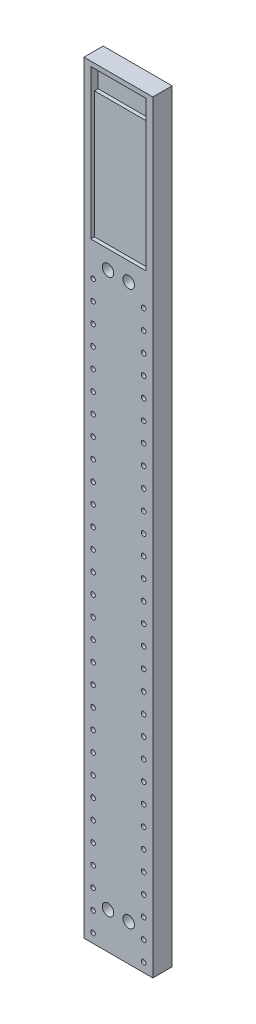
from build123d import *

# Parameters (mm, degrees)
SKETCH1_W                  = 30
SKETCH1_H                  = 330
BOSS_EXTRUDE1_DEPTH        = 8.4
SKETCH2_R                  = 1
CUT_EXTRUDE1_DEPTH         = 332.467283453
LPATTERN1_COUNT            = 30
LPATTERN1_PITCH            = 8.5
LPATTERN2_COUNT            = 2
LPATTERN2_PITCH            = 22
LPATTERN2_COPY_1_SKETCH_R  = 1
LPATTERN2_COPY_1_DEPTH     = 332.467283453
LPATTERN2_COPY_2_SKETCH_R  = 1
LPATTERN2_COPY_2_DEPTH     = 332.467283453
LPATTERN2_COPY_3_SKETCH_R  = 1
LPATTERN2_COPY_3_DEPTH     = 332.467283453
LPATTERN2_COPY_4_SKETCH_R  = 1
LPATTERN2_COPY_4_DEPTH     = 332.467283453
LPATTERN2_COPY_5_SKETCH_R  = 1
LPATTERN2_COPY_5_DEPTH     = 332.467283453
LPATTERN2_COPY_6_SKETCH_R  = 1
LPATTERN2_COPY_6_DEPTH     = 332.467283453
LPATTERN2_COPY_7_SKETCH_R  = 1
LPATTERN2_COPY_7_DEPTH     = 332.467283453
LPATTERN2_COPY_8_SKETCH_R  = 1
LPATTERN2_COPY_8_DEPTH     = 332.467283453
LPATTERN2_COPY_9_SKETCH_R  = 1
LPATTERN2_COPY_9_DEPTH     = 332.467283453
LPATTERN2_COPY_10_SKETCH_R = 1
LPATTERN2_COPY_10_DEPTH    = 332.467283453
LPATTERN2_COPY_11_SKETCH_R = 1
LPATTERN2_COPY_11_DEPTH    = 332.467283453
LPATTERN2_COPY_12_SKETCH_R = 1
LPATTERN2_COPY_12_DEPTH    = 332.467283453
LPATTERN2_COPY_13_SKETCH_R = 1
LPATTERN2_COPY_13_DEPTH    = 332.467283453
LPATTERN2_COPY_14_SKETCH_R = 1
LPATTERN2_COPY_14_DEPTH    = 332.467283453
LPATTERN2_COPY_15_SKETCH_R = 1
LPATTERN2_COPY_15_DEPTH    = 332.467283453
LPATTERN2_COPY_16_SKETCH_R = 1
LPATTERN2_COPY_16_DEPTH    = 332.467283453
LPATTERN2_COPY_17_SKETCH_R = 1
LPATTERN2_COPY_17_DEPTH    = 332.467283453
LPATTERN2_COPY_18_SKETCH_R = 1
LPATTERN2_COPY_18_DEPTH    = 332.467283453
LPATTERN2_COPY_19_SKETCH_R = 1
LPATTERN2_COPY_19_DEPTH    = 332.467283453
LPATTERN2_COPY_20_SKETCH_R = 1
LPATTERN2_COPY_20_DEPTH    = 332.467283453
LPATTERN2_COPY_21_SKETCH_R = 1
LPATTERN2_COPY_21_DEPTH    = 332.467283453
LPATTERN2_COPY_22_SKETCH_R = 1
LPATTERN2_COPY_22_DEPTH    = 332.467283453
LPATTERN2_COPY_23_SKETCH_R = 1
LPATTERN2_COPY_23_DEPTH    = 332.467283453
LPATTERN2_COPY_24_SKETCH_R = 1
LPATTERN2_COPY_24_DEPTH    = 332.467283453
LPATTERN2_COPY_25_SKETCH_R = 1
LPATTERN2_COPY_25_DEPTH    = 332.467283453
LPATTERN2_COPY_26_SKETCH_R = 1
LPATTERN2_COPY_26_DEPTH    = 332.467283453
LPATTERN2_COPY_27_SKETCH_R = 1
LPATTERN2_COPY_27_DEPTH    = 332.467283453
LPATTERN2_COPY_28_SKETCH_R = 1
LPATTERN2_COPY_28_DEPTH    = 332.467283453
LPATTERN2_COPY_29_SKETCH_R = 1
LPATTERN2_COPY_29_DEPTH    = 332.467283453
SKETCH4_W                  = 24
SKETCH4_H                  = 65
CUT_EXTRUDE2_DEPTH         = 1.6
SKETCH6_W                  = 24
SKETCH6_H                  = 10
CUT_EXTRUDE3_DEPTH         = 1.6
SKETCH7_W                  = 30
SKETCH7_H                  = 8.4
BOSS_EXTRUDE2_DEPTH        = 2
SKETCH8_R                  = 2.5
CUT_EXTRUDE4_DEPTH         = 334.458483173


with BuildPart() as part:
    # Sketch1 → Boss-Extrude1 (new body)
    with BuildSketch(Plane.XY):
        with Locations((15, 165)):
            Rectangle(SKETCH1_W, SKETCH1_H)
    extrude(amount=BOSS_EXTRUDE1_DEPTH)

    # Sketch2 → Cut-Extrude1 (cut, through all)
    with BuildSketch(Plane.XY.offset(8.4)):
        with Locations((26, 4)):
            Circle(SKETCH2_R)
    cut_extrude1 = extrude(amount=-CUT_EXTRUDE1_DEPTH, mode=Mode.SUBTRACT)

    # LPattern1: Cut-Extrude1 ×30
    with Locations(*[(0, i * LPATTERN1_PITCH, 0) for i in range(1, LPATTERN1_COUNT)]):
        add(cut_extrude1, mode=Mode.SUBTRACT)

    # LPattern2: Cut-Extrude1 ×2
    with Locations(*[(-i * LPATTERN2_PITCH, 0, 0) for i in range(1, LPATTERN2_COUNT)]):
        add(cut_extrude1, mode=Mode.SUBTRACT)

    # LPattern2 copy 1 sketch → LPattern2 copy 1 (cut, through all)
    with BuildSketch(Plane(origin=(-22, 8.5, 8.4), x_dir=(1, 0, 0), z_dir=(0, 0, 1))):
        with Locations((26, 4)):
            Circle(LPATTERN2_COPY_1_SKETCH_R)
    extrude(amount=-LPATTERN2_COPY_1_DEPTH, mode=Mode.SUBTRACT)

    # LPattern2 copy 2 sketch → LPattern2 copy 2 (cut, through all)
    with BuildSketch(Plane(origin=(-22, 17, 8.4), x_dir=(1, 0, 0), z_dir=(0, 0, 1))):
        with Locations((26, 4)):
            Circle(LPATTERN2_COPY_2_SKETCH_R)
    extrude(amount=-LPATTERN2_COPY_2_DEPTH, mode=Mode.SUBTRACT)

    # LPattern2 copy 3 sketch → LPattern2 copy 3 (cut, through all)
    with BuildSketch(Plane(origin=(-22, 25.5, 8.4), x_dir=(1, 0, 0), z_dir=(0, 0, 1))):
        with Locations((26, 4)):
            Circle(LPATTERN2_COPY_3_SKETCH_R)
    extrude(amount=-LPATTERN2_COPY_3_DEPTH, mode=Mode.SUBTRACT)

    # LPattern2 copy 4 sketch → LPattern2 copy 4 (cut, through all)
    with BuildSketch(Plane(origin=(-22, 34, 8.4), x_dir=(1, 0, 0), z_dir=(0, 0, 1))):
        with Locations((26, 4)):
            Circle(LPATTERN2_COPY_4_SKETCH_R)
    extrude(amount=-LPATTERN2_COPY_4_DEPTH, mode=Mode.SUBTRACT)

    # LPattern2 copy 5 sketch → LPattern2 copy 5 (cut, through all)
    with BuildSketch(Plane(origin=(-22, 42.5, 8.4), x_dir=(1, 0, 0), z_dir=(0, 0, 1))):
        with Locations((26, 4)):
            Circle(LPATTERN2_COPY_5_SKETCH_R)
    extrude(amount=-LPATTERN2_COPY_5_DEPTH, mode=Mode.SUBTRACT)

    # LPattern2 copy 6 sketch → LPattern2 copy 6 (cut, through all)
    with BuildSketch(Plane(origin=(-22, 51, 8.4), x_dir=(1, 0, 0), z_dir=(0, 0, 1))):
        with Locations((26, 4)):
            Circle(LPATTERN2_COPY_6_SKETCH_R)
    extrude(amount=-LPATTERN2_COPY_6_DEPTH, mode=Mode.SUBTRACT)

    # LPattern2 copy 7 sketch → LPattern2 copy 7 (cut, through all)
    with BuildSketch(Plane(origin=(-22, 59.5, 8.4), x_dir=(1, 0, 0), z_dir=(0, 0, 1))):
        with Locations((26, 4)):
            Circle(LPATTERN2_COPY_7_SKETCH_R)
    extrude(amount=-LPATTERN2_COPY_7_DEPTH, mode=Mode.SUBTRACT)

    # LPattern2 copy 8 sketch → LPattern2 copy 8 (cut, through all)
    with BuildSketch(Plane(origin=(-22, 68, 8.4), x_dir=(1, 0, 0), z_dir=(0, 0, 1))):
        with Locations((26, 4)):
            Circle(LPATTERN2_COPY_8_SKETCH_R)
    extrude(amount=-LPATTERN2_COPY_8_DEPTH, mode=Mode.SUBTRACT)

    # LPattern2 copy 9 sketch → LPattern2 copy 9 (cut, through all)
    with BuildSketch(Plane(origin=(-22, 76.5, 8.4), x_dir=(1, 0, 0), z_dir=(0, 0, 1))):
        with Locations((26, 4)):
            Circle(LPATTERN2_COPY_9_SKETCH_R)
    extrude(amount=-LPATTERN2_COPY_9_DEPTH, mode=Mode.SUBTRACT)

    # LPattern2 copy 10 sketch → LPattern2 copy 10 (cut, through all)
    with BuildSketch(Plane(origin=(-22, 85, 8.4), x_dir=(1, 0, 0), z_dir=(0, 0, 1))):
        with Locations((26, 4)):
            Circle(LPATTERN2_COPY_10_SKETCH_R)
    extrude(amount=-LPATTERN2_COPY_10_DEPTH, mode=Mode.SUBTRACT)

    # LPattern2 copy 11 sketch → LPattern2 copy 11 (cut, through all)
    with BuildSketch(Plane(origin=(-22, 93.5, 8.4), x_dir=(1, 0, 0), z_dir=(0, 0, 1))):
        with Locations((26, 4)):
            Circle(LPATTERN2_COPY_11_SKETCH_R)
    extrude(amount=-LPATTERN2_COPY_11_DEPTH, mode=Mode.SUBTRACT)

    # LPattern2 copy 12 sketch → LPattern2 copy 12 (cut, through all)
    with BuildSketch(Plane(origin=(-22, 102, 8.4), x_dir=(1, 0, 0), z_dir=(0, 0, 1))):
        with Locations((26, 4)):
            Circle(LPATTERN2_COPY_12_SKETCH_R)
    extrude(amount=-LPATTERN2_COPY_12_DEPTH, mode=Mode.SUBTRACT)

    # LPattern2 copy 13 sketch → LPattern2 copy 13 (cut, through all)
    with BuildSketch(Plane(origin=(-22, 110.5, 8.4), x_dir=(1, 0, 0), z_dir=(0, 0, 1))):
        with Locations((26, 4)):
            Circle(LPATTERN2_COPY_13_SKETCH_R)
    extrude(amount=-LPATTERN2_COPY_13_DEPTH, mode=Mode.SUBTRACT)

    # LPattern2 copy 14 sketch → LPattern2 copy 14 (cut, through all)
    with BuildSketch(Plane(origin=(-22, 119, 8.4), x_dir=(1, 0, 0), z_dir=(0, 0, 1))):
        with Locations((26, 4)):
            Circle(LPATTERN2_COPY_14_SKETCH_R)
    extrude(amount=-LPATTERN2_COPY_14_DEPTH, mode=Mode.SUBTRACT)

    # LPattern2 copy 15 sketch → LPattern2 copy 15 (cut, through all)
    with BuildSketch(Plane(origin=(-22, 127.5, 8.4), x_dir=(1, 0, 0), z_dir=(0, 0, 1))):
        with Locations((26, 4)):
            Circle(LPATTERN2_COPY_15_SKETCH_R)
    extrude(amount=-LPATTERN2_COPY_15_DEPTH, mode=Mode.SUBTRACT)

    # LPattern2 copy 16 sketch → LPattern2 copy 16 (cut, through all)
    with BuildSketch(Plane(origin=(-22, 136, 8.4), x_dir=(1, 0, 0), z_dir=(0, 0, 1))):
        with Locations((26, 4)):
            Circle(LPATTERN2_COPY_16_SKETCH_R)
    extrude(amount=-LPATTERN2_COPY_16_DEPTH, mode=Mode.SUBTRACT)

    # LPattern2 copy 17 sketch → LPattern2 copy 17 (cut, through all)
    with BuildSketch(Plane(origin=(-22, 144.5, 8.4), x_dir=(1, 0, 0), z_dir=(0, 0, 1))):
        with Locations((26, 4)):
            Circle(LPATTERN2_COPY_17_SKETCH_R)
    extrude(amount=-LPATTERN2_COPY_17_DEPTH, mode=Mode.SUBTRACT)

    # LPattern2 copy 18 sketch → LPattern2 copy 18 (cut, through all)
    with BuildSketch(Plane(origin=(-22, 153, 8.4), x_dir=(1, 0, 0), z_dir=(0, 0, 1))):
        with Locations((26, 4)):
            Circle(LPATTERN2_COPY_18_SKETCH_R)
    extrude(amount=-LPATTERN2_COPY_18_DEPTH, mode=Mode.SUBTRACT)

    # LPattern2 copy 19 sketch → LPattern2 copy 19 (cut, through all)
    with BuildSketch(Plane(origin=(-22, 161.5, 8.4), x_dir=(1, 0, 0), z_dir=(0, 0, 1))):
        with Locations((26, 4)):
            Circle(LPATTERN2_COPY_19_SKETCH_R)
    extrude(amount=-LPATTERN2_COPY_19_DEPTH, mode=Mode.SUBTRACT)

    # LPattern2 copy 20 sketch → LPattern2 copy 20 (cut, through all)
    with BuildSketch(Plane(origin=(-22, 170, 8.4), x_dir=(1, 0, 0), z_dir=(0, 0, 1))):
        with Locations((26, 4)):
            Circle(LPATTERN2_COPY_20_SKETCH_R)
    extrude(amount=-LPATTERN2_COPY_20_DEPTH, mode=Mode.SUBTRACT)

    # LPattern2 copy 21 sketch → LPattern2 copy 21 (cut, through all)
    with BuildSketch(Plane(origin=(-22, 178.5, 8.4), x_dir=(1, 0, 0), z_dir=(0, 0, 1))):
        with Locations((26, 4)):
            Circle(LPATTERN2_COPY_21_SKETCH_R)
    extrude(amount=-LPATTERN2_COPY_21_DEPTH, mode=Mode.SUBTRACT)

    # LPattern2 copy 22 sketch → LPattern2 copy 22 (cut, through all)
    with BuildSketch(Plane(origin=(-22, 187, 8.4), x_dir=(1, 0, 0), z_dir=(0, 0, 1))):
        with Locations((26, 4)):
            Circle(LPATTERN2_COPY_22_SKETCH_R)
    extrude(amount=-LPATTERN2_COPY_22_DEPTH, mode=Mode.SUBTRACT)

    # LPattern2 copy 23 sketch → LPattern2 copy 23 (cut, through all)
    with BuildSketch(Plane(origin=(-22, 195.5, 8.4), x_dir=(1, 0, 0), z_dir=(0, 0, 1))):
        with Locations((26, 4)):
            Circle(LPATTERN2_COPY_23_SKETCH_R)
    extrude(amount=-LPATTERN2_COPY_23_DEPTH, mode=Mode.SUBTRACT)

    # LPattern2 copy 24 sketch → LPattern2 copy 24 (cut, through all)
    with BuildSketch(Plane(origin=(-22, 204, 8.4), x_dir=(1, 0, 0), z_dir=(0, 0, 1))):
        with Locations((26, 4)):
            Circle(LPATTERN2_COPY_24_SKETCH_R)
    extrude(amount=-LPATTERN2_COPY_24_DEPTH, mode=Mode.SUBTRACT)

    # LPattern2 copy 25 sketch → LPattern2 copy 25 (cut, through all)
    with BuildSketch(Plane(origin=(-22, 212.5, 8.4), x_dir=(1, 0, 0), z_dir=(0, 0, 1))):
        with Locations((26, 4)):
            Circle(LPATTERN2_COPY_25_SKETCH_R)
    extrude(amount=-LPATTERN2_COPY_25_DEPTH, mode=Mode.SUBTRACT)

    # LPattern2 copy 26 sketch → LPattern2 copy 26 (cut, through all)
    with BuildSketch(Plane(origin=(-22, 221, 8.4), x_dir=(1, 0, 0), z_dir=(0, 0, 1))):
        with Locations((26, 4)):
            Circle(LPATTERN2_COPY_26_SKETCH_R)
    extrude(amount=-LPATTERN2_COPY_26_DEPTH, mode=Mode.SUBTRACT)

    # LPattern2 copy 27 sketch → LPattern2 copy 27 (cut, through all)
    with BuildSketch(Plane(origin=(-22, 229.5, 8.4), x_dir=(1, 0, 0), z_dir=(0, 0, 1))):
        with Locations((26, 4)):
            Circle(LPATTERN2_COPY_27_SKETCH_R)
    extrude(amount=-LPATTERN2_COPY_27_DEPTH, mode=Mode.SUBTRACT)

    # LPattern2 copy 28 sketch → LPattern2 copy 28 (cut, through all)
    with BuildSketch(Plane(origin=(-22, 238, 8.4), x_dir=(1, 0, 0), z_dir=(0, 0, 1))):
        with Locations((26, 4)):
            Circle(LPATTERN2_COPY_28_SKETCH_R)
    extrude(amount=-LPATTERN2_COPY_28_DEPTH, mode=Mode.SUBTRACT)

    # LPattern2 copy 29 sketch → LPattern2 copy 29 (cut, through all)
    with BuildSketch(Plane(origin=(-22, 246.5, 8.4), x_dir=(1, 0, 0), z_dir=(0, 0, 1))):
        with Locations((26, 4)):
            Circle(LPATTERN2_COPY_29_SKETCH_R)
    extrude(amount=-LPATTERN2_COPY_29_DEPTH, mode=Mode.SUBTRACT)

    # Sketch4 → Cut-Extrude2 (cut)
    with BuildSketch(Plane.XY.offset(8.4)):
        with Locations((15, 297.5)):
            Rectangle(SKETCH4_W, SKETCH4_H)
    extrude(amount=-CUT_EXTRUDE2_DEPTH, mode=Mode.SUBTRACT)

    # Sketch6 → Cut-Extrude3 (cut)
    with BuildSketch(Plane.XY.offset(6.8)):
        with Locations((15, 325)):
            Rectangle(SKETCH6_W, SKETCH6_H)
    extrude(amount=-CUT_EXTRUDE3_DEPTH, mode=Mode.SUBTRACT)

    # Sketch7 → Boss-Extrude2 (add)
    with BuildSketch(Plane(origin=(0, 330, 0), x_dir=(1, 0, 0), z_dir=(0, 1, 0))):
        with Locations((15, -4.2)):
            Rectangle(SKETCH7_W, SKETCH7_H)
    extrude(amount=BOSS_EXTRUDE2_DEPTH)

    # Sketch8 → Cut-Extrude4 (cut, through all)
    with BuildSketch(Plane.XY.offset(8.4)):
        with Locations((10.5, 16)):
            Circle(SKETCH8_R)
        with Locations((19.5, 257)):
            Circle(SKETCH8_R)
        with Locations((19.5, 16)):
            Circle(SKETCH8_R)
        with Locations((10.5, 257)):
            Circle(SKETCH8_R)
    extrude(amount=-CUT_EXTRUDE4_DEPTH, mode=Mode.SUBTRACT)


solid = part.part
